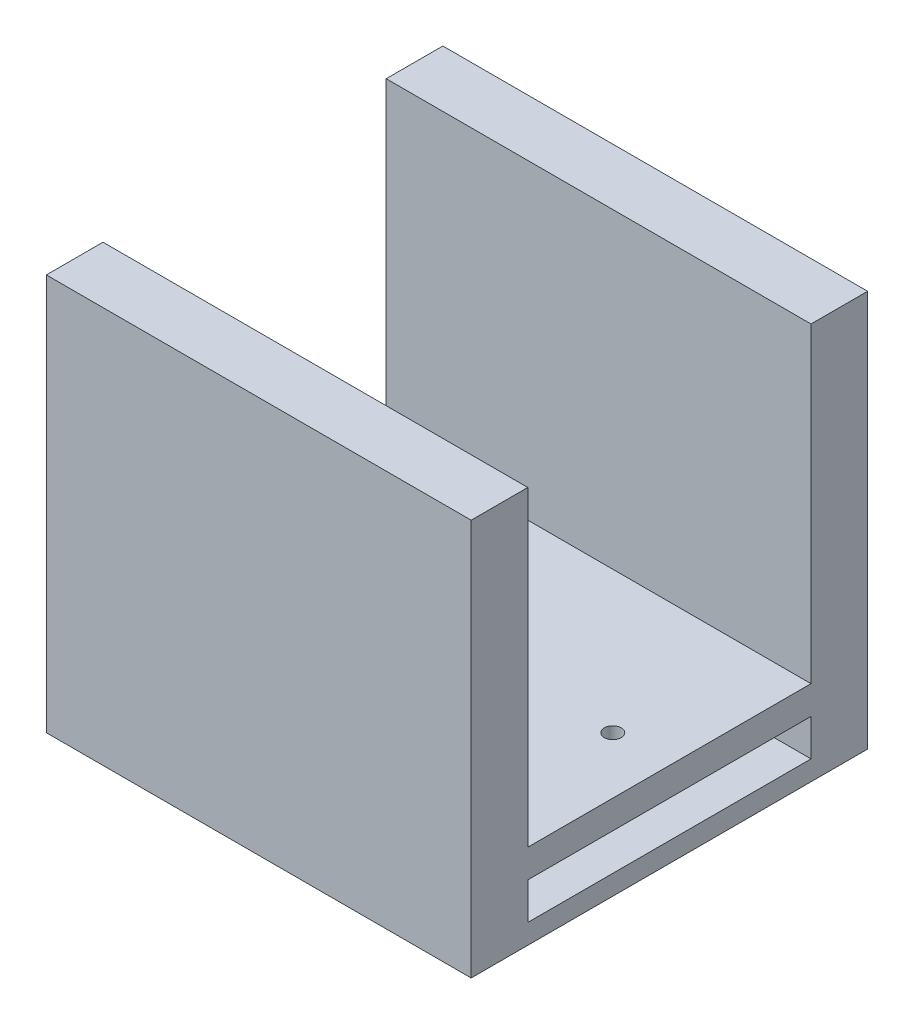
from build123d import *

# Parameters (mm, degrees)
SKETCH_2_W          = 150
SKETCH_2_H          = 140
EXTRUDE_1_DEPTH     = 140
SKETCH_3_W          = 150
SKETCH_3_H          = 100
CUT_EXTRUDE_1_DEPTH = 110
SKETCH_4_W          = 100
SKETCH_4_H          = 13
CUT_EXTRUDE_2_DEPTH = 231.131739112
SKETCH_5_R          = 3
CUT_EXTRUDE_3_DEPTH = 50
SKETCH_6_R          = 3
CUT_EXTRUDE_4_DEPTH = 177.679477459


with BuildPart() as part:
    # 草圖2 → 填料-伸長1 (new body)
    with BuildSketch(Plane(origin=(0, 0, 0), x_dir=(1, 0, 0), z_dir=(0, 1, 0))):
        with Locations((15.857142857, -34.214285714)):
            Rectangle(SKETCH_2_W, SKETCH_2_H)
    extrude(amount=EXTRUDE_1_DEPTH)

    # 草圖3 → 除料-伸長1 (cut)
    with BuildSketch(Plane(origin=(0, 140, 0), x_dir=(1, 0, 0), z_dir=(0, 1, 0))):
        with Locations((15.857142857, -34.214285714)):
            Rectangle(SKETCH_3_W, SKETCH_3_H)
    extrude(amount=-CUT_EXTRUDE_1_DEPTH, mode=Mode.SUBTRACT)

    # 草圖4 → 除料-伸長2 (cut, through all)
    with BuildSketch(Plane(origin=(90.857142857, 0, 0), x_dir=(0, 0, -1), z_dir=(1, 0, 0))):
        with Locations((-34.214285714, 13.5)):
            Rectangle(SKETCH_4_W, SKETCH_4_H)
    extrude(amount=-CUT_EXTRUDE_2_DEPTH, mode=Mode.SUBTRACT)

    # 草圖5 → 除料-伸長3 (cut)
    with BuildSketch(Plane(origin=(0, 30, 0), x_dir=(1, 0, 0), z_dir=(0, 1, 0))):
        with Locations(Location((70.857142857, -34.214285714, 0), (0, 0, 270))):
            Circle(SKETCH_5_R)
    extrude(amount=-CUT_EXTRUDE_3_DEPTH, mode=Mode.SUBTRACT)

    # 草圖6 → 除料-伸長4 (cut, through all)
    with BuildSketch(Plane(origin=(0, 30, 0), x_dir=(1, 0, 0), z_dir=(0, 1, 0))):
        with Locations(Location((-29.142857143, -34.214285714, 0), (0, 0, 270))):
            Circle(SKETCH_6_R)
    extrude(amount=-CUT_EXTRUDE_4_DEPTH, mode=Mode.SUBTRACT)


solid = part.part
